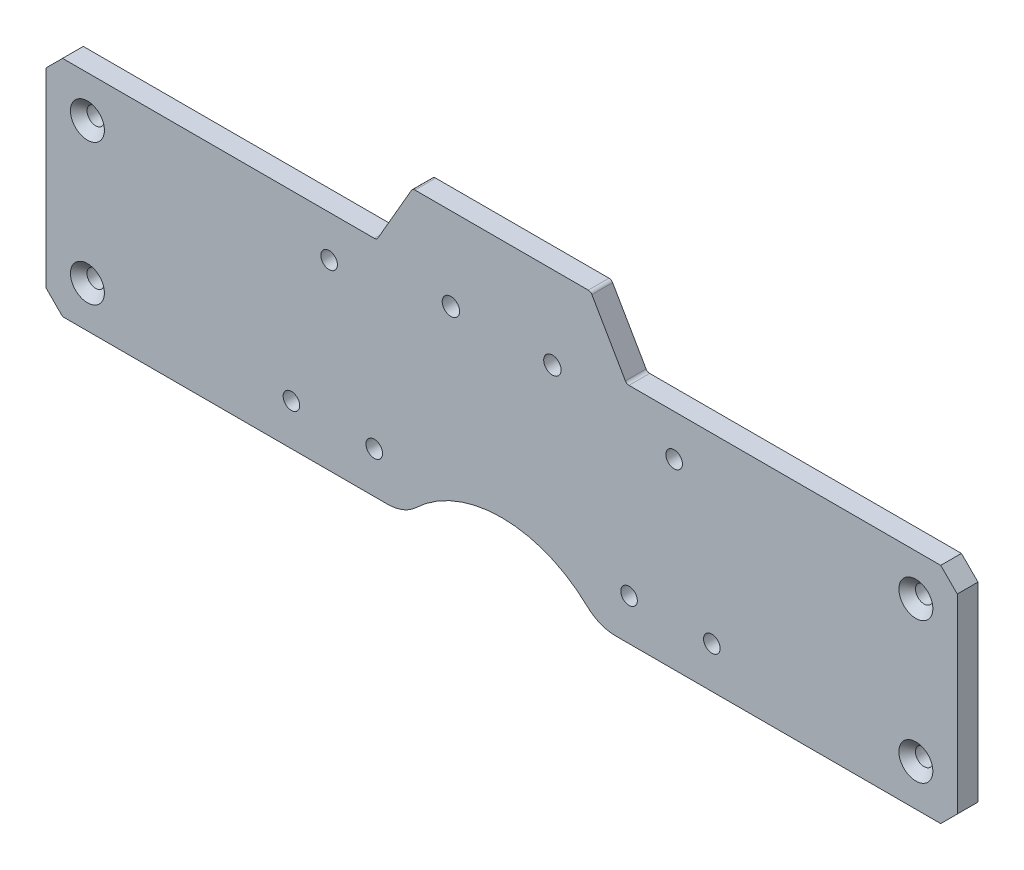
from build123d import *

# Parameters (mm, degrees)
SKETCH_1_W          = 220
SKETCH_1_H          = 54
SKETCH_1_R          = 2.1
EXTRUDE_1_DEPTH     = 2.5
CHAMFER_1_SIZE      = 4
CHAMFER_2_SIZE      = 2
SKETCH_3_R          = 2
CUT_EXTRUDE_1_DEPTH = 114.375482358
SKETCH_4_R          = 30
CUT_EXTRUDE_2_DEPTH = 114.375482358
FILLET_1_R          = 10
EXTRUDE_2_DEPTH     = 5
FILLET_2_R          = 1


with BuildPart() as part:
    # 草图1 → 凸台-拉伸1 (new, symmetric)
    with BuildSketch(Plane.XY):
        Rectangle(SKETCH_1_W, SKETCH_1_H)
        with Locations((-100, 17)):
            Circle(SKETCH_1_R, mode=Mode.SUBTRACT)
        with Locations((-100, -17)):
            Circle(SKETCH_1_R, mode=Mode.SUBTRACT)
        with Locations((100, 17)):
            Circle(SKETCH_1_R, mode=Mode.SUBTRACT)
        with Locations((100, -17)):
            Circle(SKETCH_1_R, mode=Mode.SUBTRACT)
        with Locations((-12.25, 22)):
            Circle(SKETCH_1_R, mode=Mode.SUBTRACT)
        with Locations((12.25, 22)):
            Circle(SKETCH_1_R, mode=Mode.SUBTRACT)
    extrude(amount=EXTRUDE_1_DEPTH, both=True)

    # 倒角1
    chamfer_1_edges = [part.edges().sort_by_distance(p)[0] for p in [
        (-110, 27, 0),
        (110, 27, 0),
        (110, -27, 0),
        (-110, -27, 0),
    ]]
    chamfer(chamfer_1_edges, length=CHAMFER_1_SIZE)

    # 倒角2
    chamfer_2_edges = [part.edges().sort_by_distance(p)[0] for p in [
        (-102.1, 17, 2.5),
        (-102.1, -17, 2.5),
        (97.9, 17, 2.5),
        (97.9, -17, 2.5),
        (-14.35, 22, -2.5),
        (10.15, 22, -2.5),
    ]]
    chamfer(chamfer_2_edges, length=CHAMFER_2_SIZE)

    # 草图3 → 切除-拉伸1 (cut, through all)
    with BuildSketch(Plane.XY.offset(2.5)):
        with Locations((50.753537587, -17)):
            Circle(SKETCH_3_R)
        with Locations((41.643265044, 17)):
            Circle(SKETCH_3_R)
        with Locations((30.753537587, -17)):
            Circle(SKETCH_3_R)
        with Locations(Location((-41.643265044, 17, 0), (0, 0, 180))):
            Circle(SKETCH_3_R)
        with Locations(Location((-50.753537587, -17, 0), (0, 0, 180))):
            Circle(SKETCH_3_R)
        with Locations(Location((-30.753537587, -17, 0), (0, 0, 180))):
            Circle(SKETCH_3_R)
    extrude(amount=-CUT_EXTRUDE_1_DEPTH, mode=Mode.SUBTRACT)

    # 草图4 → 切除-拉伸2 (cut, through all)
    with BuildSketch(Plane.XY.offset(2.5)):
        with Locations((0, -46)):
            Circle(SKETCH_4_R)
    extrude(amount=-CUT_EXTRUDE_2_DEPTH, mode=Mode.SUBTRACT)

    # 圆角1
    fillet_1_edges = [part.edges().sort_by_distance(p)[0] for p in [
        (23.216373532, -27, 0),
        (-23.216373532, -27, 0),
    ]]
    fillet(fillet_1_edges, radius=FILLET_1_R)

    # 草图5 → 凸台-拉伸2 (add)
    with BuildSketch(Plane(origin=(0, 0, -2.5), x_dir=(-1, 0, 0), z_dir=(0, 0, -1))):
        Polygon((-21.5, 42), (21.5, 42), (30.160254038, 27), (-30.160254038, 27), align=None)
    extrude(amount=-EXTRUDE_2_DEPTH)

    # 圆角2
    fillet_2_edges = [part.edges().sort_by_distance(p)[0] for p in [
        (-30.160254038, 27, 0),
        (-21.5, 42, 0),
        (21.5, 42, 0),
        (30.160254038, 27, 0),
    ]]
    fillet(fillet_2_edges, radius=FILLET_2_R)


solid = part.part
